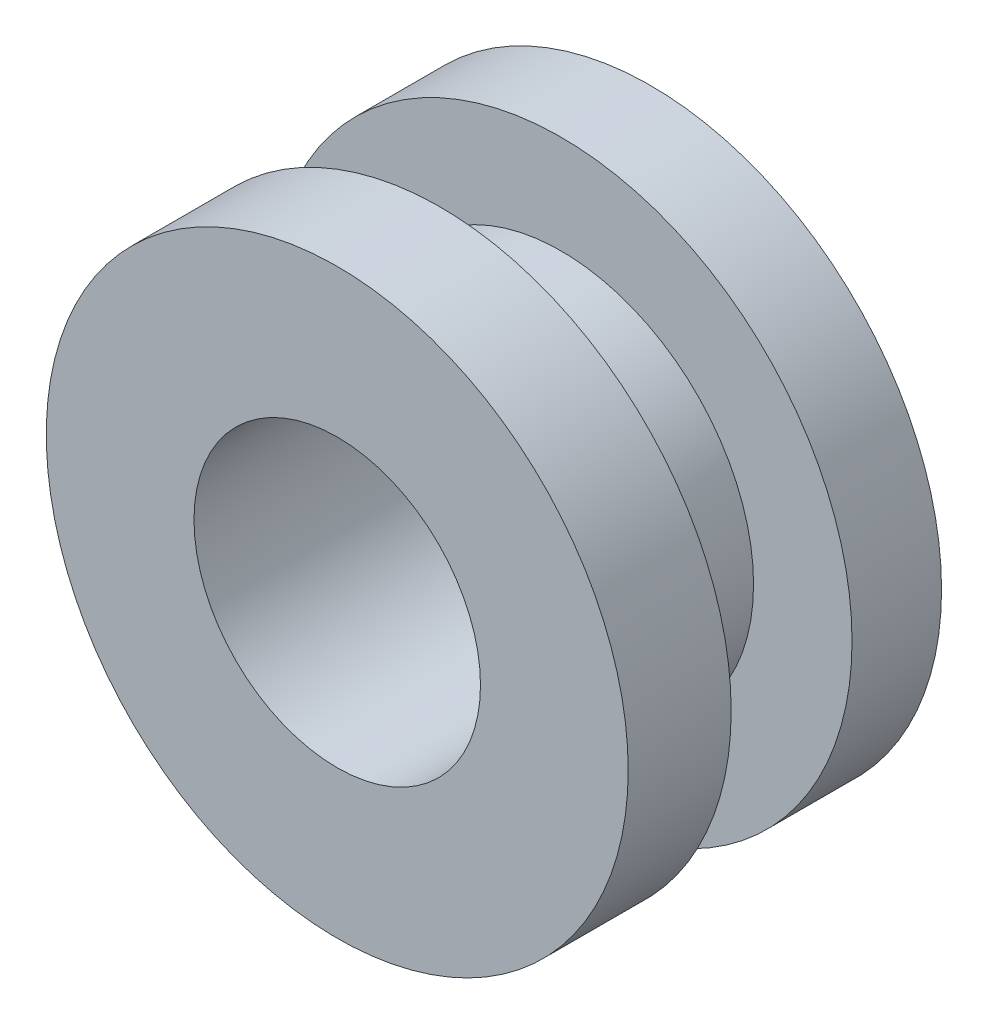
from build123d import *

# Parameters (mm, degrees)
FURO_COM_FOLGA_DE_M61_D = 6.4


with BuildPart() as part:
    # Esboço1 → Revolução1 (revolve)
    with BuildSketch(Plane(origin=(0, 0, 0), x_dir=(0, 0, -1), z_dir=(1, 0, 0))):
        Polygon((-0.44395252, 0), (0, 0), (0, 6.5), (-2, 6.5), (-2, 4.3), (-4.7, 4.3), (-4.7, 6.5), (-7, 6.5), (-7, 0), align=None)
    revolve(axis=Axis((0, 0, 7), (0, 0, -1)))

    # Furo com folga de M61 (through all)
    with Locations(Plane(origin=(0, 0, 0), x_dir=(-1, 0, 0), z_dir=(0, 0, -1))):
        with Locations((0, 0)):
            Hole(FURO_COM_FOLGA_DE_M61_D / 2)


solid = part.part
